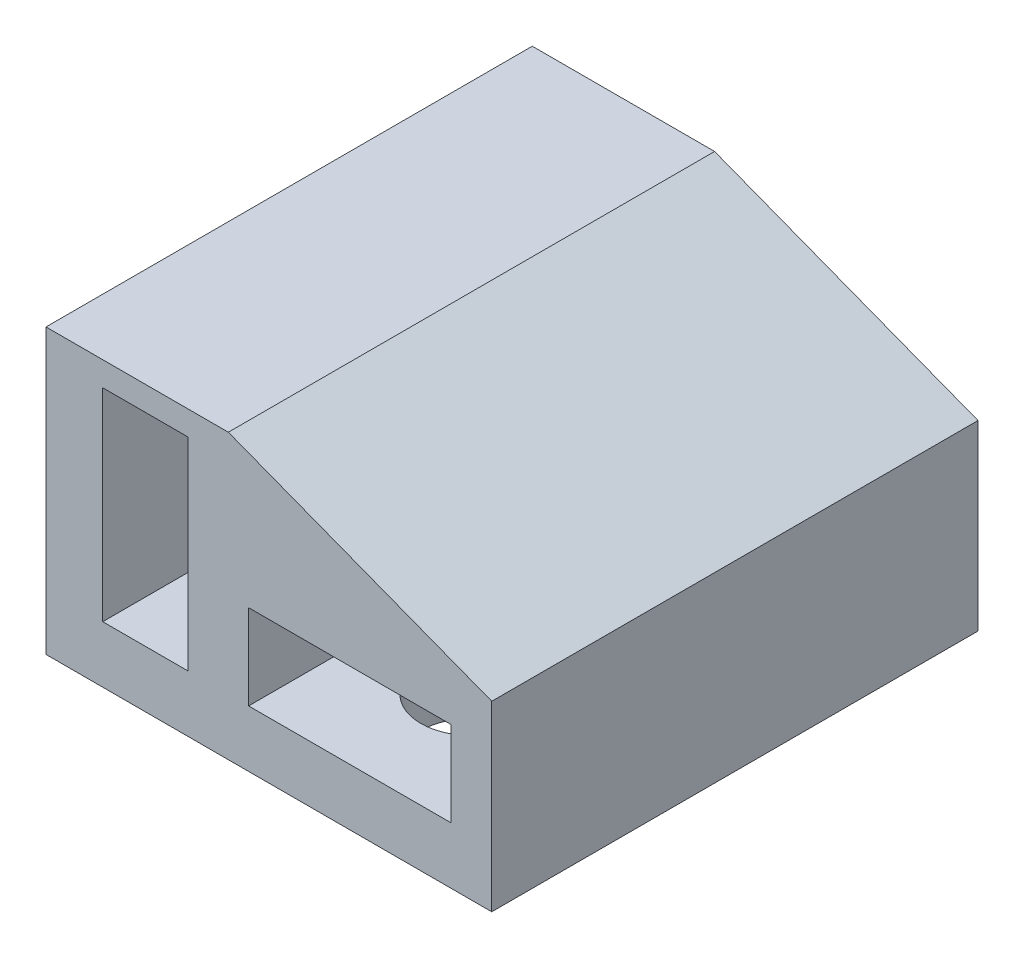
from build123d import *

# Parameters (mm, degrees)
BOSS_EXTRUDE1_DEPTH = 12
CUT_EXTRUDE1_DEPTH  = 3.5
SKETCH3_W           = 1.4
SKETCH3_H           = 12
BOSS_EXTRUDE2_DEPTH = 7
SKETCH4_R           = 1.25
CUT_EXTRUDE2_DEPTH  = 3.5
SKETCH5_W           = 7
SKETCH5_H           = 1.4
BOSS_EXTRUDE3_DEPTH = 12
SKETCH6_R           = 1.25
CUT_EXTRUDE3_DEPTH  = 3.5
SKETCH4_3_R         = 1.25
CUT_EXTRUDE4_DEPTH  = 3.5


with BuildPart() as part:
    # Sketch1 → Boss-Extrude1 (new body)
    with BuildSketch(Plane.XY):
        Polygon((0, 0), (0, 7), (4.5, 7), (11, 4.5), (11, 0), align=None)
    extrude(amount=BOSS_EXTRUDE1_DEPTH)

    # Sketch2 → Cut-Extrude1 (cut)
    with BuildSketch(Plane.ZY):
        Polygon((5.886751346, 3.9), (4.443375673, 6.4), (0, 6.4), (0, 1.4), (4.443375673, 1.4), align=None)
        Polygon((7.556624327, 6.4), (6.113248654, 3.9), (7.556624327, 1.4), (12, 1.4), (12, 6.4), align=None)
    extrude(amount=-CUT_EXTRUDE1_DEPTH, mode=Mode.SUBTRACT)

    # Sketch3 → Boss-Extrude2 (add)
    with BuildSketch(Plane(origin=(0, 7, 0), x_dir=(1, 0, 0), z_dir=(0, 1, 0))):
        with Locations((0.7, -6)):
            Rectangle(SKETCH3_W, SKETCH3_H)
    extrude(amount=-BOSS_EXTRUDE2_DEPTH)

    # Sketch4 → Cut-Extrude2 (cut)
    # profile 1 of 2: a face of its own
    with BuildSketch(Plane.XZ):
        Polygon((7.5, 6.113248654), (10, 7.556624327), (10, 12), (5, 12), (5, 7.556624327), align=None)
    # profile 2 of 2: a face of its own
    with BuildSketch(Plane.XZ):
        Polygon((7.5, 5.886751346), (5, 4.443375673), (5, 0), (10, 0), (10, 4.443375673), align=None)
        with Locations((7.5, 3)):
            Circle(SKETCH4_R, mode=Mode.SUBTRACT)
    extrude(amount=-CUT_EXTRUDE2_DEPTH, mode=Mode.SUBTRACT)

    # Sketch5 → Boss-Extrude3 (add)
    with BuildSketch(Plane(origin=(0, 0, 0), x_dir=(-1, 0, 0), z_dir=(0, 0, -1))):
        with Locations((-7.5, 0.7)):
            Rectangle(SKETCH5_W, SKETCH5_H)
    extrude(amount=-BOSS_EXTRUDE3_DEPTH)

    # Sketch6 → Cut-Extrude3 (cut)
    with BuildSketch(Plane.ZY):
        with Locations((3.5, 3.9)):
            Circle(SKETCH6_R)
        with Locations((8.5, 3.9)):
            Circle(SKETCH6_R)
    extrude(amount=-CUT_EXTRUDE3_DEPTH, mode=Mode.SUBTRACT)

    # Sketch4<3> → Cut-Extrude4 (cut)
    with BuildSketch(Plane.XZ):
        with Locations((7.5, 9)):
            Circle(SKETCH4_3_R)
        with Locations((7.5, 3)):
            Circle(SKETCH4_3_R)
    extrude(amount=-CUT_EXTRUDE4_DEPTH, mode=Mode.SUBTRACT)


solid = part.part
